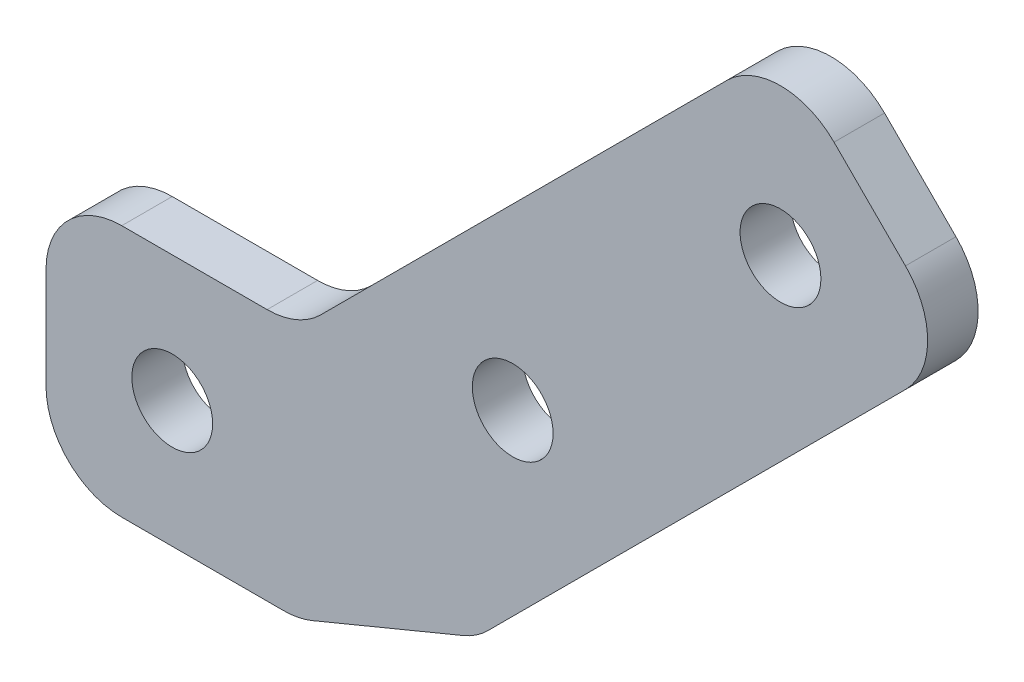
from build123d import *

# Parameters (mm, degrees)
SKETCH_1_R      = 1.6
EXTRUDE_2_DEPTH = 2
FILLET_1_R      = 3


with BuildPart() as part:
    # ｽｹｯﾁ1 → ﾎﾞｽ - 押し出し2 (new body)
    with BuildSketch(Plane.XY):
        Polygon((10, 10), (29.091883092, 29.091883092), (36.162950904, 22.02081528), (17.071067812, 2.928932188), (10, 0), (0, 0), (0, 10), align=None)
        with Locations((5, 5)):
            Circle(SKETCH_1_R, mode=Mode.SUBTRACT)
        with Locations((29.091883092, 22.02081528)):
            Circle(SKETCH_1_R, mode=Mode.SUBTRACT)
        with Locations((18.485281374, 11.414213562)):
            Circle(SKETCH_1_R, mode=Mode.SUBTRACT)
    extrude(amount=EXTRUDE_2_DEPTH)

    # ﾌｨﾚｯﾄ1
    fillet_1_edges = [part.edges().sort_by_distance(p)[0] for p in [
        (0, 0, 1),
        (0, 10, 1),
        (10, 10, 1),
        (29.091883092, 29.091883092, 1),
        (36.162950904, 22.02081528, 1),
        (17.071067812, 2.928932188, 1),
        (10, 0, 1),
    ]]
    fillet(fillet_1_edges, radius=FILLET_1_R)


solid = part.part
